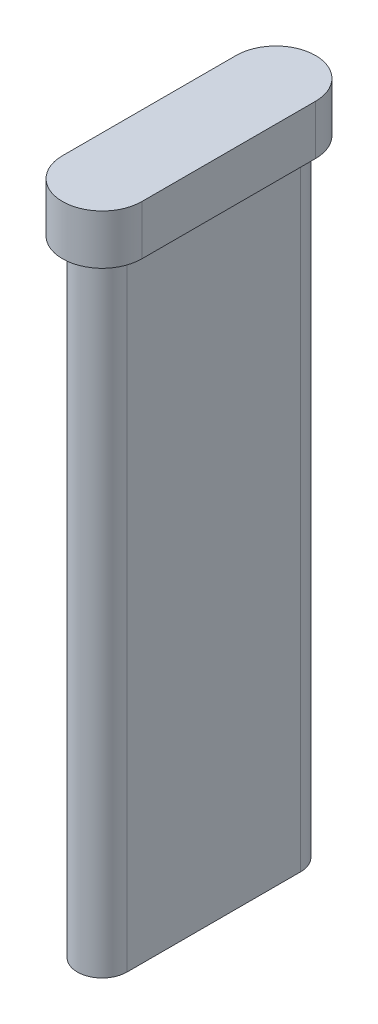
from build123d import *

# Parameters (mm, degrees)
BOSS_EXTRUDE1_DEPTH = 68
BOSS_EXTRUDE2_DEPTH = 5


with BuildPart() as part:
    # Sketch1 → Boss-Extrude1 (new body)
    with BuildSketch(Plane(origin=(0, 0, 0), x_dir=(1, 0, 0), z_dir=(0, 1, 0))):
        with BuildLine():
            Line((-2.5, -8.75), (-2.5, 8.75))
            ThreePointArc((-2.5, 8.75), (0, 11.25), (2.5, 8.75))
            Line((2.5, 8.75), (2.5, -8.75))
            ThreePointArc((2.5, -8.75), (0, -11.25), (-2.5, -8.75))
        make_face()
    extrude(amount=-BOSS_EXTRUDE1_DEPTH)

    # Sketch2 → Boss-Extrude2 (add)
    with BuildSketch(Plane(origin=(0, 0, 0), x_dir=(1, 0, 0), z_dir=(0, 1, 0))):
        with BuildLine():
            Line((4, -8.75), (4, 8.75))
            ThreePointArc((4, 8.75), (0, 12.75), (-4, 8.75))
            Line((-4, 8.75), (-4, -8.75))
            ThreePointArc((-4, -8.75), (0, -12.75), (4, -8.75))
        make_face()
    extrude(amount=-BOSS_EXTRUDE2_DEPTH)


solid = part.part
